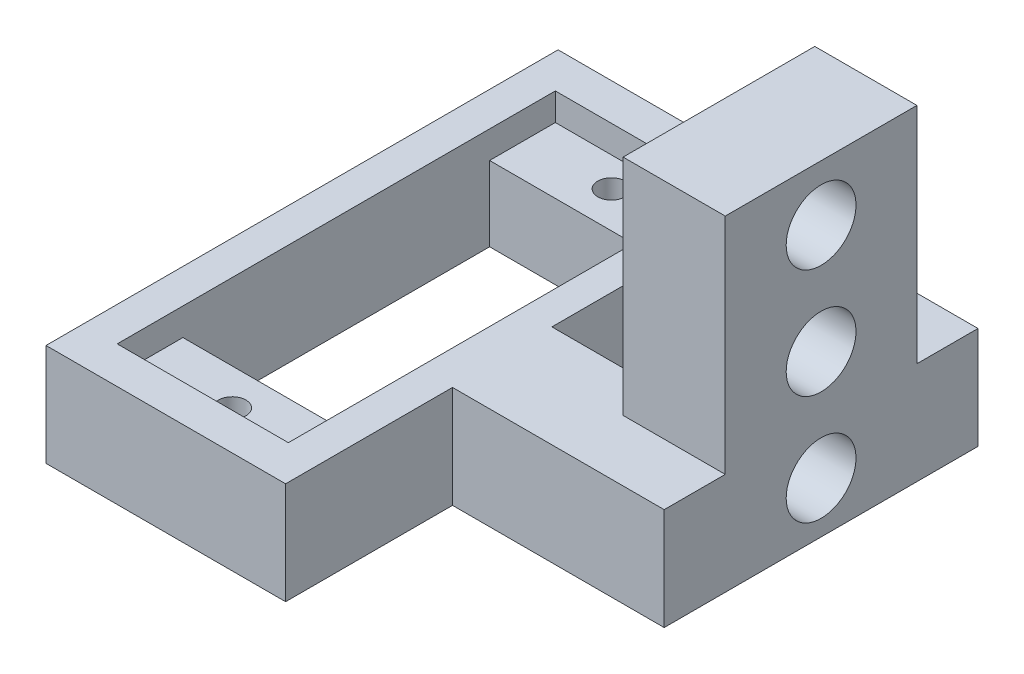
from build123d import *

# Parameters (mm, degrees)
SKETCH4_R           = 1
SKETCH4_W           = 8.2
SKETCH4_H           = 8
SKETCH4_W_2         = 12.5
SKETCH4_H_2         = 22.4
BOSS_EXTRUDE2_DEPTH = 7.46
SKETCH8_W           = 7.46
SKETCH8_H           = 14
BOSS_EXTRUDE4_DEPTH = 16.34
SKETCH9_R           = 2.55
CUT_EXTRUDE2_DEPTH  = 43.142763317
SKETCH12_W          = 12.5
SKETCH12_H          = 32
CUT_EXTRUDE5_DEPTH  = 2


with BuildPart() as part:
    # Sketch4 → Boss-Extrude2 (new body)
    with BuildSketch(Plane(origin=(0, 0, 0), x_dir=(1, 0, 0), z_dir=(0, 1, 0))):
        Polygon((8.75, 11.46), (24.21, 11.46), (24.21, -11.46), (8.75, -11.46), (8.75, -23.65), (-8.75, -23.65), (-8.75, 13.75), (8.75, 13.75), align=None)
        with Locations(Location((0, 8.9, 0), (0, 0, 90))):
            Circle(SKETCH4_R, mode=Mode.SUBTRACT)
        with Locations(Location((0, -18.8, 0), (0, 0, 90))):
            Circle(SKETCH4_R, mode=Mode.SUBTRACT)
        with Locations((12.65, 0)):
            Rectangle(SKETCH4_W, SKETCH4_H, mode=Mode.SUBTRACT)
        with Locations((0, -4.95)):
            Rectangle(SKETCH4_W_2, SKETCH4_H_2, mode=Mode.SUBTRACT)
    extrude(amount=BOSS_EXTRUDE2_DEPTH)

    # Sketch8 → Boss-Extrude4 (add)
    with BuildSketch(Plane(origin=(0, 7.46, 0), x_dir=(1, 0, 0), z_dir=(0, 1, 0))):
        with Locations((20.48, 0)):
            Rectangle(SKETCH8_W, SKETCH8_H)
    extrude(amount=BOSS_EXTRUDE4_DEPTH)

    # Sketch9 → Cut-Extrude2 (cut, through all)
    with BuildSketch(Plane.ZY.offset(-16.75)):
        with Locations((0, 3.73)):
            Circle(SKETCH9_R)
        with Locations((0, 11.73)):
            Circle(SKETCH9_R)
        with Locations((0, 19.73)):
            Circle(SKETCH9_R)
    extrude(amount=-CUT_EXTRUDE2_DEPTH, mode=Mode.SUBTRACT)

    # Sketch12 → Cut-Extrude5 (cut)
    with BuildSketch(Plane(origin=(0, 7.46, 0), x_dir=(1, 0, 0), z_dir=(0, 1, 0))):
        with Locations((0, -4.95)):
            Rectangle(SKETCH12_W, SKETCH12_H)
    extrude(amount=-CUT_EXTRUDE5_DEPTH, mode=Mode.SUBTRACT)


solid = part.part
